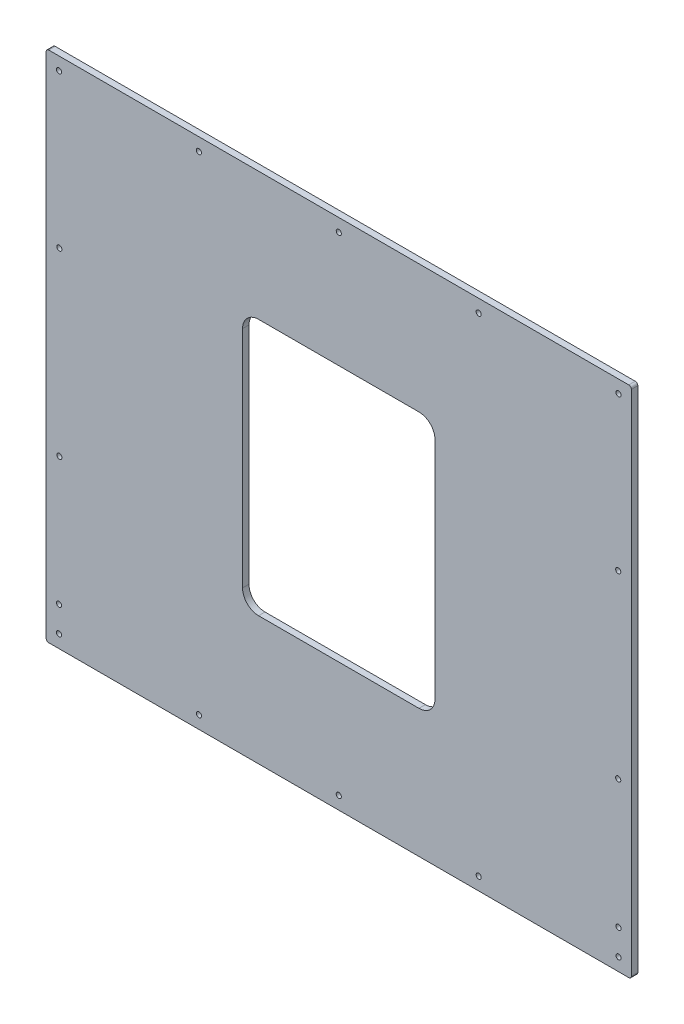
from build123d import *

# Parameters (mm, degrees)
ESQUISSE1_R             = 4
BOSS_EXTRU_1_DEPTH      = 10
ENL_V_MAT_EXTRU_1_DEPTH = 607.65970692


with BuildPart() as part:
    # Esquisse1 → Boss.-Extru.1 (new body)
    with BuildSketch(Plane.XY):
        with BuildLine():
            Line((-452, -400), (452, -400))
            ThreePointArc((452, -400), (454.828427125, -398.828427125), (456, -396))
            Line((456, -396), (456, 396))
            ThreePointArc((456, 396), (454.828427125, 398.828427125), (452, 400))
            Line((452, 400), (-452, 400))
            ThreePointArc((-452, 400), (-454.828427125, 398.828427125), (-456, 396))
            Line((-456, 396), (-456, -396))
            ThreePointArc((-456, -396), (-454.828427125, -398.828427125), (-452, -400))
        make_face()
        with Locations((436, 380)):
            Circle(ESQUISSE1_R, mode=Mode.SUBTRACT)
        with Locations((435.5, -140)):
            Circle(ESQUISSE1_R, mode=Mode.SUBTRACT)
        with Locations((435.5, 141)):
            Circle(ESQUISSE1_R, mode=Mode.SUBTRACT)
        with Locations(Location((-435.5, -140, 0), (0, 0, 180))):
            Circle(ESQUISSE1_R, mode=Mode.SUBTRACT)
        with Locations(Location((-436, 380, 0), (0, 0, 180))):
            Circle(ESQUISSE1_R, mode=Mode.SUBTRACT)
        with Locations(Location((-435.5, 141, 0), (0, 0, 180))):
            Circle(ESQUISSE1_R, mode=Mode.SUBTRACT)
        with Locations(Location((436, -380, 0), (0, 0, 180))):
            Circle(ESQUISSE1_R, mode=Mode.SUBTRACT)
        with Locations(Location((436, -340, 0), (0, 0, 180))):
            Circle(ESQUISSE1_R, mode=Mode.SUBTRACT)
        with Locations((-436, -340)):
            Circle(ESQUISSE1_R, mode=Mode.SUBTRACT)
        with Locations((-436, -380)):
            Circle(ESQUISSE1_R, mode=Mode.SUBTRACT)
        with Locations(Location((218, -380, 0), (0, 0, 180))):
            Circle(ESQUISSE1_R, mode=Mode.SUBTRACT)
        with Locations(Location((0, -380, 0), (0, 0, 180))):
            Circle(ESQUISSE1_R, mode=Mode.SUBTRACT)
        with Locations(Location((-218, -380, 0), (0, 0, 180))):
            Circle(ESQUISSE1_R, mode=Mode.SUBTRACT)
        with Locations((-218, 380)):
            Circle(ESQUISSE1_R, mode=Mode.SUBTRACT)
        with Locations((0, 380)):
            Circle(ESQUISSE1_R, mode=Mode.SUBTRACT)
        with Locations((218, 380)):
            Circle(ESQUISSE1_R, mode=Mode.SUBTRACT)
    extrude(amount=BOSS_EXTRU_1_DEPTH)

    # Esquisse2 → Enlèv. mat.-Extru.1 (cut, through all)
    with BuildSketch(Plane.XY.offset(10)):
        with BuildLine():
            Line((-125, -200), (125, -200))
            ThreePointArc((125, -200), (142.67766953, -192.67766953), (150, -175))
            Line((150, -175), (150, 175))
            ThreePointArc((150, 175), (142.67766953, 192.67766953), (125, 200))
            Line((125, 200), (-125, 200))
            ThreePointArc((-125, 200), (-142.67766953, 192.67766953), (-150, 175))
            Line((-150, 175), (-150, -175))
            ThreePointArc((-150, -175), (-142.67766953, -192.67766953), (-125, -200))
        make_face()
    extrude(amount=-ENL_V_MAT_EXTRU_1_DEPTH, mode=Mode.SUBTRACT)


solid = part.part
